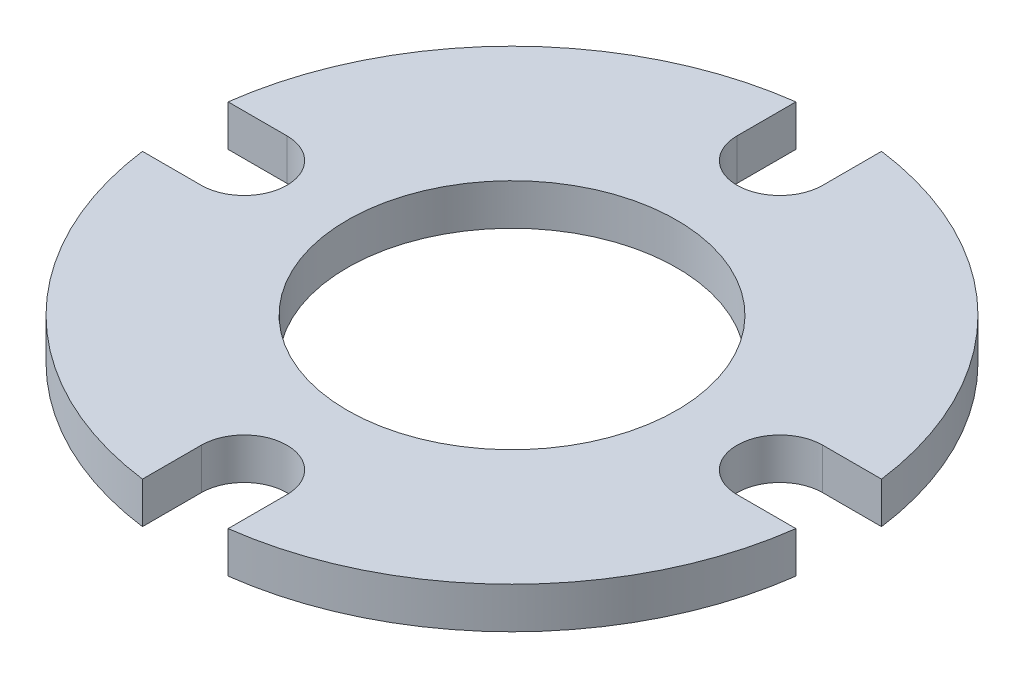
from build123d import *

# Parameters (mm, degrees)
SKETCH1_R           = 12.7
BOSS_EXTRUDE1_DEPTH = 1.5875


with BuildPart() as part:
    # Sketch1 → Boss-Extrude1 (new, symmetric)
    with BuildSketch(Plane(origin=(0, 0, 0), x_dir=(1, 0, 0), z_dir=(0, 1, 0))):
        with BuildLine():
            Line((3.302, 20.6502), (3.302, 25.184455444))
            ThreePointArc((3.302, 25.184455444), (17.960512242, 17.960512242), (25.184455444, 3.302))
            Line((25.184455444, 3.302), (20.6502, 3.302))
            ThreePointArc((20.6502, 3.302), (17.3482, 0), (20.6502, -3.302))
            Line((20.6502, -3.302), (25.184455444, -3.302))
            ThreePointArc((25.184455444, -3.302), (17.960512242, -17.960512242), (3.302, -25.184455444))
            Line((3.302, -25.184455444), (3.302, -20.6502))
            ThreePointArc((3.302, -20.6502), (0, -17.3482), (-3.302, -20.6502))
            Line((-3.302, -20.6502), (-3.302, -25.184455444))
            ThreePointArc((-3.302, -25.184455444), (-17.960512242, -17.960512242), (-25.184455444, -3.302))
            Line((-25.184455444, -3.302), (-20.6502, -3.302))
            ThreePointArc((-20.6502, -3.302), (-17.3482, 0), (-20.6502, 3.302))
            Line((-20.6502, 3.302), (-25.184455444, 3.302))
            ThreePointArc((-25.184455444, 3.302), (-17.960512242, 17.960512242), (-3.302, 25.184455444))
            Line((-3.302, 25.184455444), (-3.302, 20.6502))
            ThreePointArc((-3.302, 20.6502), (0, 17.3482), (3.302, 20.6502))
        make_face()
        with Locations(Location((0, 0, 0), (0, 0, 270))):
            Circle(SKETCH1_R, mode=Mode.SUBTRACT)
    extrude(amount=BOSS_EXTRUDE1_DEPTH, both=True)


solid = part.part
